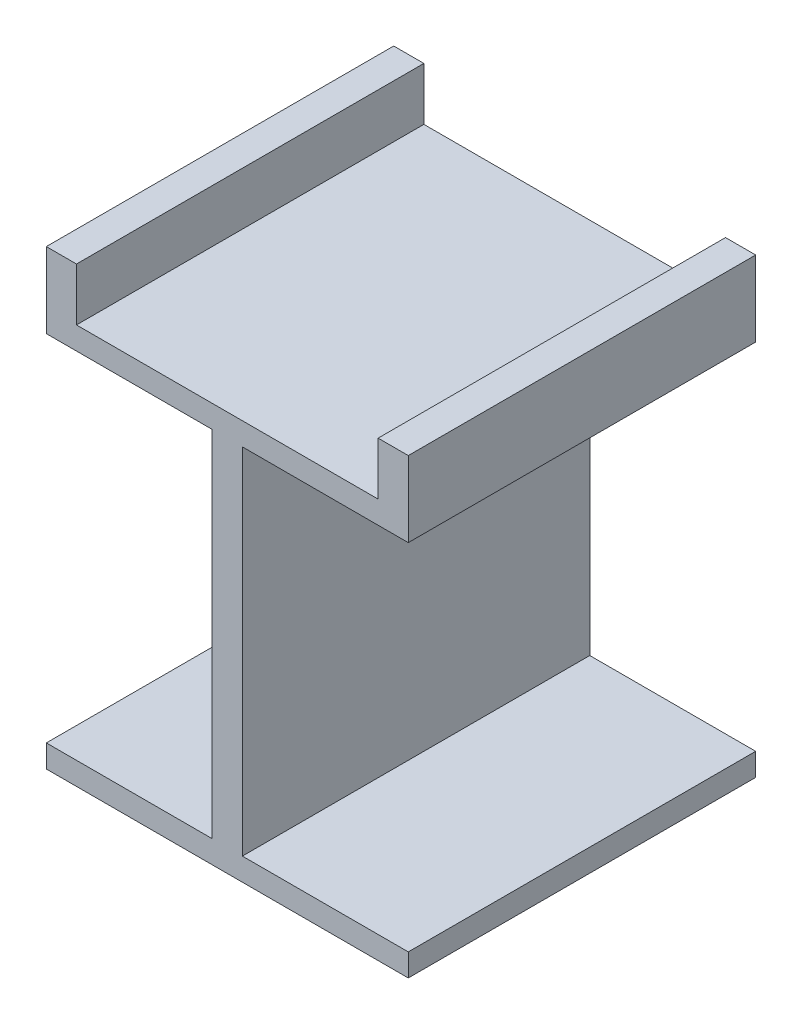
from build123d import *

# Parameters (mm, degrees)
IZIM1_W                     = 48
IZIM1_H                     = 46.07
Y_KSEKLIK_EKSTR_ZYON1_DEPTH = 3
IZIM2_W                     = 4
IZIM2_H                     = 46.07
Y_KSEKLIK_EKSTR_ZYON2_DEPTH = 50
IZIM3_W                     = 4
IZIM3_H                     = 46.07
Y_KSEKLIK_EKSTR_ZYON3_DEPTH = 7


with BuildPart() as part:
    # Çizim1 → Yükseklik-Ekstrüzyon1 (new body)
    with BuildSketch(Plane(origin=(0, 0, 0), x_dir=(1, 0, 0), z_dir=(0, 1, 0))):
        Rectangle(IZIM1_W, IZIM1_H)
    y_kseklik_ekstr_zyon1 = extrude(amount=Y_KSEKLIK_EKSTR_ZYON1_DEPTH)

    # Çizim2 → Yükseklik-Ekstrüzyon2 (add)
    with BuildSketch(Plane(origin=(0, 3, 0), x_dir=(1, 0, 0), z_dir=(0, 1, 0))):
        Rectangle(IZIM2_W, IZIM2_H)
    extrude(amount=Y_KSEKLIK_EKSTR_ZYON2_DEPTH)

    # Aynalama1: Yükseklik-Ekstrüzyon1 across plane
    add(y_kseklik_ekstr_zyon1.mirror(Plane.ZX.offset(26.5)))

    # Çizim3 → Yükseklik-Ekstrüzyon3 (add)
    with BuildSketch(Plane(origin=(0, 53, 0), x_dir=(1, 0, 0), z_dir=(0, 1, 0))):
        with Locations((22, 0)):
            Rectangle(IZIM3_W, IZIM3_H)
    y_kseklik_ekstr_zyon3 = extrude(amount=Y_KSEKLIK_EKSTR_ZYON3_DEPTH)

    # Aynalama2: Yükseklik-Ekstrüzyon3 across plane
    add(y_kseklik_ekstr_zyon3.mirror(Plane(origin=(0, 0, 0), x_dir=(0, 0, 1), z_dir=(1, 0, 0))))


solid = part.part
